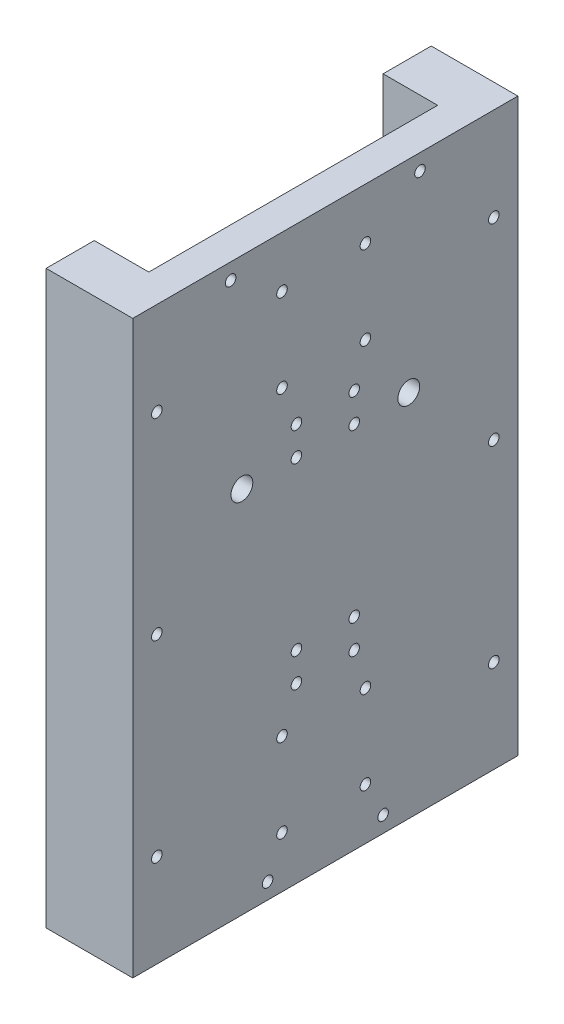
from build123d import *

# Parameters (mm, degrees)
SKETCH_1_W             = 120
SKETCH_1_H             = 178
EXTRUDE_1_DEPTH        = 10
SKETCH_2_W             = 15
SKETCH_2_H             = 178
EXTRUDE_2_DEPTH        = 17
SKETCH_3_W             = 70
SKETCH_3_H             = 24
CUT_EXTRUDE_1_DEPTH    = 5
HOLE_WIZARD_M4_1_D     = 3.3
PATTERN_LINEAR_1_COUNT = 3
PATTERN_LINEAR_1_PITCH = 60
HOLE_WIZARD_M4_2_D     = 3.3
HOLE_WIZARD_M8_1_D     = 6.8
HOLE_WIZARD_M4_7_D     = 3.3
HOLE_WIZARD_M4_3_D     = 3.3
HOLE_WIZARD_M4_5_D     = 3.3
HOLE_WIZARD_M4_6_D     = 3.3


with BuildPart() as part:
    # 草图1 → 凸台-拉伸1 (new body)
    with BuildSketch(Plane(origin=(0, 0, 0), x_dir=(0, 0, -1), z_dir=(1, 0, 0))):
        with Locations((60, 89)):
            Rectangle(SKETCH_1_W, SKETCH_1_H)
    extrude(amount=EXTRUDE_1_DEPTH)

    # 草图2 → 凸台-拉伸2 (add)
    with BuildSketch(Plane.ZY):
        with Locations((-112.5, 89)):
            Rectangle(SKETCH_2_W, SKETCH_2_H)
        with Locations((-7.5, 89)):
            Rectangle(SKETCH_2_W, SKETCH_2_H)
    extrude(amount=EXTRUDE_2_DEPTH)

    # 草图3 → 切除-拉伸1 (cut)
    with BuildSketch(Plane.ZY):
        with Locations((-60, 115)):
            Rectangle(SKETCH_3_W, SKETCH_3_H)
    extrude(amount=-CUT_EXTRUDE_1_DEPTH, mode=Mode.SUBTRACT)

    # M4 螺纹孔1 (through all)
    with Locations(Plane(origin=(-17, 149, -112.5), x_dir=(0, 0, -1), z_dir=(-1, 0, 0))):
        with Locations((0, 0), (-105, 0)):
            hole_wizard_m4_1 = Hole(HOLE_WIZARD_M4_1_D / 2)

    # 阵列(线性)1: M4 螺纹孔1 ×3
    with Locations(*[(0, -i * PATTERN_LINEAR_1_PITCH, 0) for i in range(1, PATTERN_LINEAR_1_COUNT)]):
        add(hole_wizard_m4_1, mode=Mode.SUBTRACT)

    # M4 螺纹孔2 (through all)
    with Locations(Plane(origin=(0, 173, -89.5), x_dir=(0, 0, -1), z_dir=(-1, 0, 0))):
        with Locations((0, 0), (-59, 0), (-11.5, 168), (-47.5, 168)):
            Hole(HOLE_WIZARD_M4_2_D / 2)

    # M8 螺纹孔1 (through all)
    with Locations(Plane(origin=(0, 115, -86), x_dir=(0, 0, -1), z_dir=(-1, 0, 0))):
        with Locations((0, 0), (-52, 0)):
            Hole(HOLE_WIZARD_M8_1_D / 2)

    # M4 螺纹孔7 (through all)
    with Locations(Plane(origin=(0, 115, -69), x_dir=(0, 0, -1), z_dir=(-1, 0, 0))):
        with Locations((0, 0), (-18, 0), (0, -9), (-18, -9)):
            Hole(HOLE_WIZARD_M4_7_D / 2)

    # M4 螺纹孔3 (through all)
    with Locations(Plane(origin=(0, 63, -69), x_dir=(0, 0, -1), z_dir=(-1, 0, 0))):
        with Locations((0, 0), (-18, 0), (0, 9), (-18, 9)):
            Hole(HOLE_WIZARD_M4_3_D / 2)

    # M4 螺纹孔5 (through all)
    with Locations(Plane(origin=(0, 162, -72.5), x_dir=(0, 0, -1), z_dir=(-1, 0, 0))):
        with Locations((0, 0), (-26, 0), (0, 146), (-26, 146), (-26, 120), (0, 120)):
            Hole(HOLE_WIZARD_M4_5_D / 2)

    # M4 螺纹孔6 (through all)
    with Locations(Plane(origin=(0, 136, -72.5), x_dir=(0, 0, -1), z_dir=(-1, 0, 0))):
        with Locations((0, 0), (-26, 0)):
            Hole(HOLE_WIZARD_M4_6_D / 2)


solid = part.part
